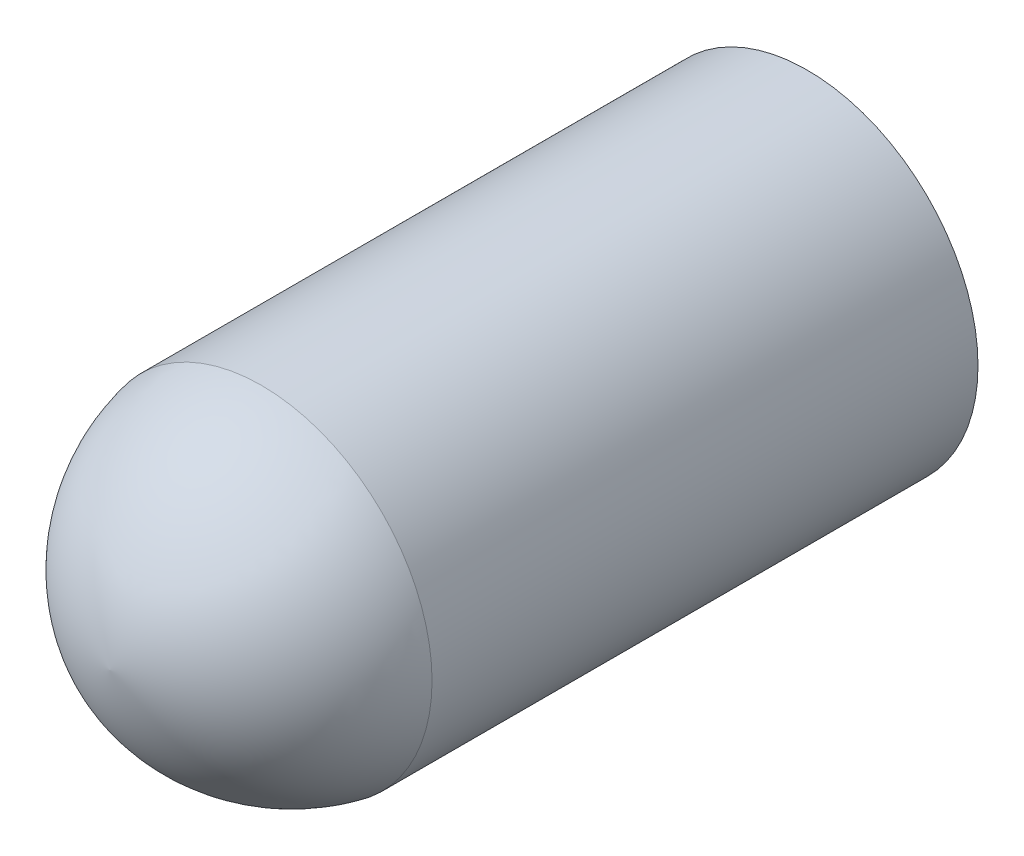
from build123d import *

# Parameters (mm, degrees)
SKETCH1_R           = 22.5
BOSS_EXTRUDE1_DEPTH = 36
SKETCH3_R           = 15
CUT_EXTRUDE1_DEPTH  = 30


with BuildPart() as part:
    # Sketch1 → Boss-Extrude1 (new, symmetric)
    with BuildSketch(Plane.XY):
        Circle(SKETCH1_R)
    extrude(amount=BOSS_EXTRUDE1_DEPTH, both=True)

    # Sketch2 → Revolve1 (revolve)
    with BuildSketch(Plane(origin=(0, 0, 0), x_dir=(0, 0, -1), z_dir=(1, 0, 0))):
        with BuildLine():
            Line((-36, 22.5), (-36, 0))
            Line((-36, 0), (-56, 0))
            ThreePointArc((-56, 0), (-49.766270837, 14.5977963), (-36, 22.5))
        make_face()
    revolve(axis=Axis((0, 0, 36), (0, 0, 1)))

    # Sketch3 → Cut-Extrude1 (cut)
    with BuildSketch(Plane(origin=(0, 0, -36), x_dir=(-1, 0, 0), z_dir=(0, 0, -1))):
        Circle(SKETCH3_R)
    extrude(amount=-CUT_EXTRUDE1_DEPTH, mode=Mode.SUBTRACT)


solid = part.part
